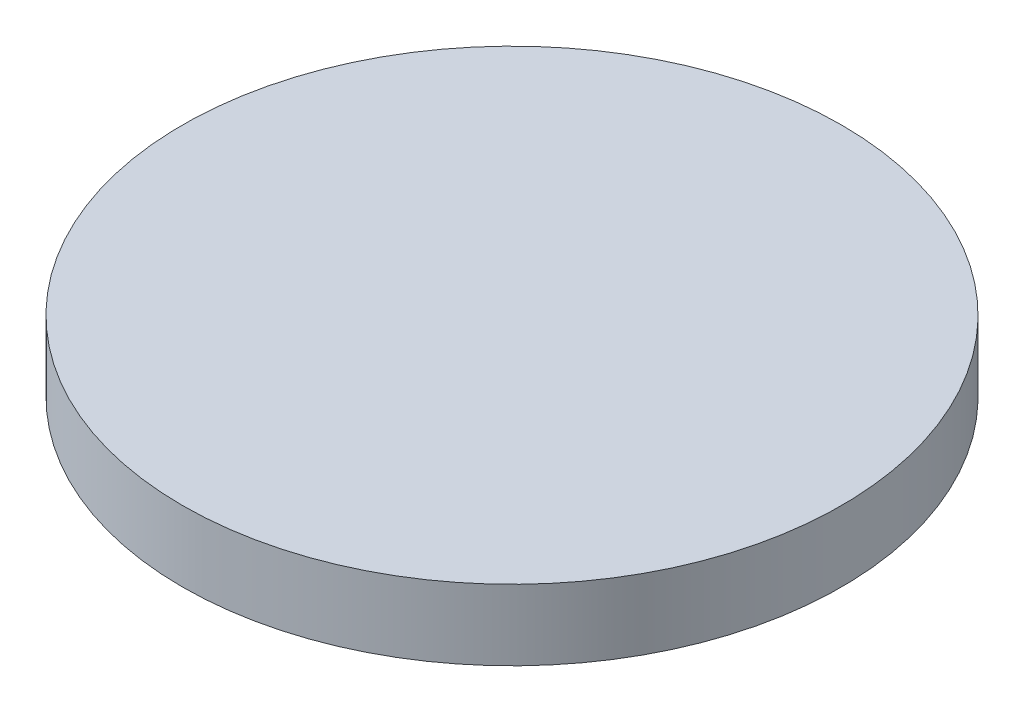
from build123d import *

# Parameters (mm, degrees)
SKETCH1_R           = 88.9
BOSS_EXTRUDE1_DEPTH = 19.05


with BuildPart() as part:
    # Sketch1 → Boss-Extrude1 (new body)
    with BuildSketch(Plane(origin=(0, 0, 0), x_dir=(1, 0, 0), z_dir=(0, 1, 0))):
        with Locations(Location((0, 0, 0), (0, 0, 90))):
            Circle(SKETCH1_R)
    extrude(amount=BOSS_EXTRUDE1_DEPTH)


solid = part.part
